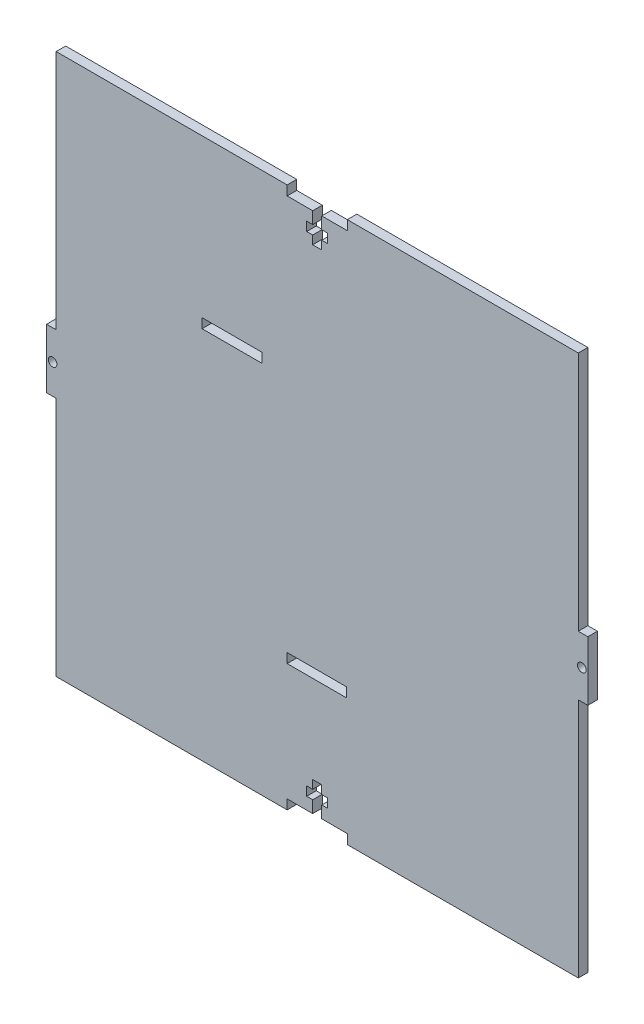
from build123d import *

# Parameters (mm, degrees)
SKETCH3_W           = 180
SKETCH3_H           = 180
SKETCH3_W_2         = 20
SKETCH3_H_2         = 3.18
SKETCH3_W_3         = 19.75
BOSS_EXTRUDE1_DEPTH = 3.18
CUT_EXTRUDE1_DEPTH  = 128.318939675
SKETCH5_R           = 1.436023081
SKETCH5_W           = 3.18
SKETCH5_H           = 80.125
CUT_EXTRUDE2_DEPTH  = 128.318939675


with BuildPart() as part:
    # Sketch3 → Boss-Extrude1 (new body)
    with BuildSketch(Plane.XY):
        Rectangle(SKETCH3_W, SKETCH3_H)
        with Locations((-28.286899392, 36.024803222)):
            Rectangle(SKETCH3_W_2, SKETCH3_H_2, mode=Mode.SUBTRACT)
        with Locations((-0.125, -46.269729843)):
            Rectangle(SKETCH3_W_3, SKETCH3_H_2, mode=Mode.SUBTRACT)
    extrude(amount=BOSS_EXTRUDE1_DEPTH)

    # Sketch4 → Cut-Extrude1 (cut, through all)
    with BuildSketch(Plane.XY.offset(3.18)):
        Polygon((1.5, 86.82), (10, 86.82), (10, 90), (-10, 90), (-10, 86.82), (-1.5, 86.82), (-1.5, 82.82), (-3.5, 82.82), (-3.5, 79.82), (-1.5, 79.82), (-1.5, 77), (1.5, 77), (1.5, 79.82), (3.5, 79.82), (3.5, 82.82), (1.5, 82.82), align=None)
        Polygon((1.5, -79.82), (1.5, -77), (-1.5, -77), (-1.5, -79.82), (-3.5, -79.82), (-3.5, -82.82), (-1.5, -82.82), (-1.5, -86.82), (-10, -86.82), (-10, -90), (10, -90), (10, -86.82), (1.5, -86.82), (1.5, -82.82), (3.5, -82.82), (3.5, -79.82), align=None)
    extrude(amount=-CUT_EXTRUDE1_DEPTH, mode=Mode.SUBTRACT)

    # Sketch5 → Cut-Extrude2 (cut, through all)
    with BuildSketch(Plane.XY.offset(3.18)):
        with Locations((-88, 0)):
            Circle(SKETCH5_R)
        with Locations((88, 0)):
            Circle(SKETCH5_R)
        with Locations((-88.41, 49.9375)):
            Rectangle(SKETCH5_W, SKETCH5_H)
        with Locations((-88.41, -49.9375)):
            Rectangle(SKETCH5_W, SKETCH5_H)
        with Locations((88.41, -49.9375)):
            Rectangle(SKETCH5_W, SKETCH5_H)
        with Locations((88.41, 49.9375)):
            Rectangle(SKETCH5_W, SKETCH5_H)
    extrude(amount=-CUT_EXTRUDE2_DEPTH, mode=Mode.SUBTRACT)


solid = part.part
